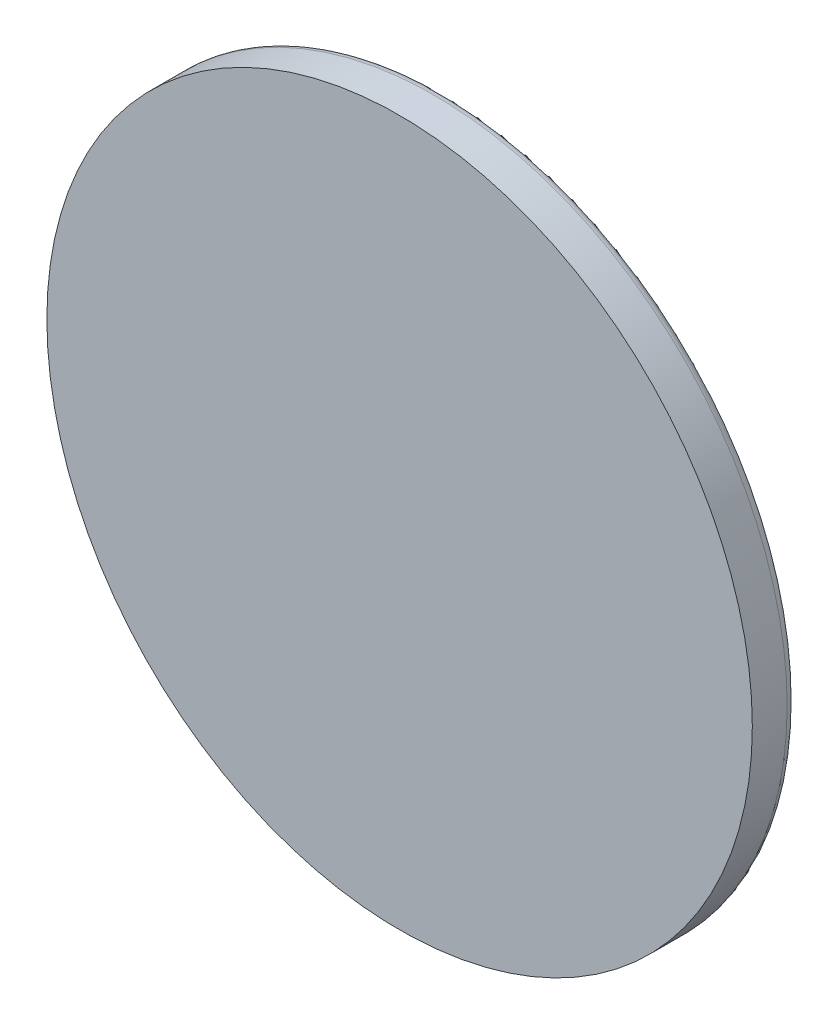
from build123d import *

# Parameters (mm, degrees)
SKETCH1_R           = 18.65
BOSS_EXTRUDE1_DEPTH = 2.3495
SKETCH4_R           = 12.446
BOSS_EXTRUDE2_DEPTH = 4.0005
SKETCH5_R           = 3.3275
CUT_EXTRUDE1_DEPTH  = 5.85
FILLET1_R           = 0.508


with BuildPart() as part:
    # Sketch1 → Boss-Extrude1 (new body)
    with BuildSketch(Plane.XY):
        with Locations((-43, 22.86)):
            Circle(SKETCH1_R)
    extrude(amount=-BOSS_EXTRUDE1_DEPTH)

    # Sketch4 → Boss-Extrude2 (add)
    with BuildSketch(Plane(origin=(0, 0, -2.3495), x_dir=(-1, 0, 0), z_dir=(0, 0, -1))):
        with Locations(Location((43, 22.86, 0), (0, 0, 180))):
            Circle(SKETCH4_R)
    extrude(amount=BOSS_EXTRUDE2_DEPTH)

    # Sketch5 → Cut-Extrude1 (cut)
    with BuildSketch(Plane(origin=(0, 0, -6.35), x_dir=(-1, 0, 0), z_dir=(0, 0, -1))):
        with Locations((43, 29.083)):
            Circle(SKETCH5_R)
        with Locations(Location((43, 16.637, 0), (0, 0, 180))):
            Circle(SKETCH5_R)
    extrude(amount=-CUT_EXTRUDE1_DEPTH, mode=Mode.SUBTRACT)

    # Fillet1
    fillet1_edges = [part.edges().sort_by_distance(p)[0] for p in [
        (-61.65, 22.86, -2.3495),
        (-55.446, 22.86, -2.3495),
        (-55.446, 22.86, -6.35),
    ]]
    fillet(fillet1_edges, radius=FILLET1_R)


solid = part.part
